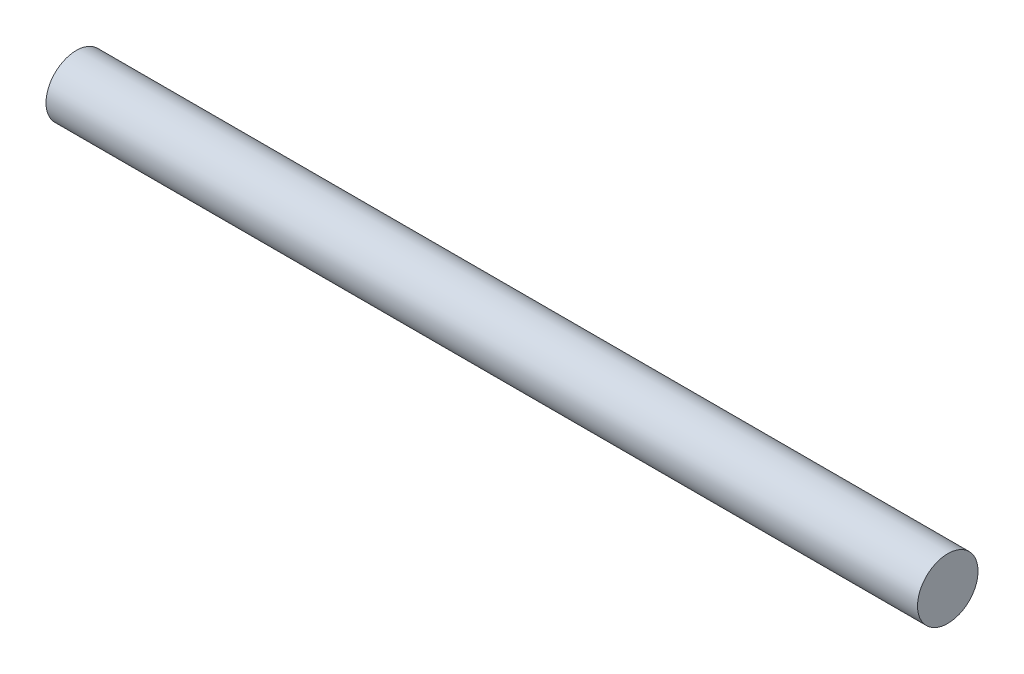
from build123d import *

# Parameters (mm, degrees)
SKETCH_1_R      = 25
EXTRUDE_1_DEPTH = 720


with BuildPart() as part:
    # Эскиз1 → Бобышка-Вытянуть1 (new body)
    with BuildSketch(Plane(origin=(0, 0, 0), x_dir=(0, 0, -1), z_dir=(1, 0, 0))):
        with Locations(Location((0, 0, 0), (0, 0, 180))):
            Circle(SKETCH_1_R)
    extrude(amount=EXTRUDE_1_DEPTH)


solid = part.part
